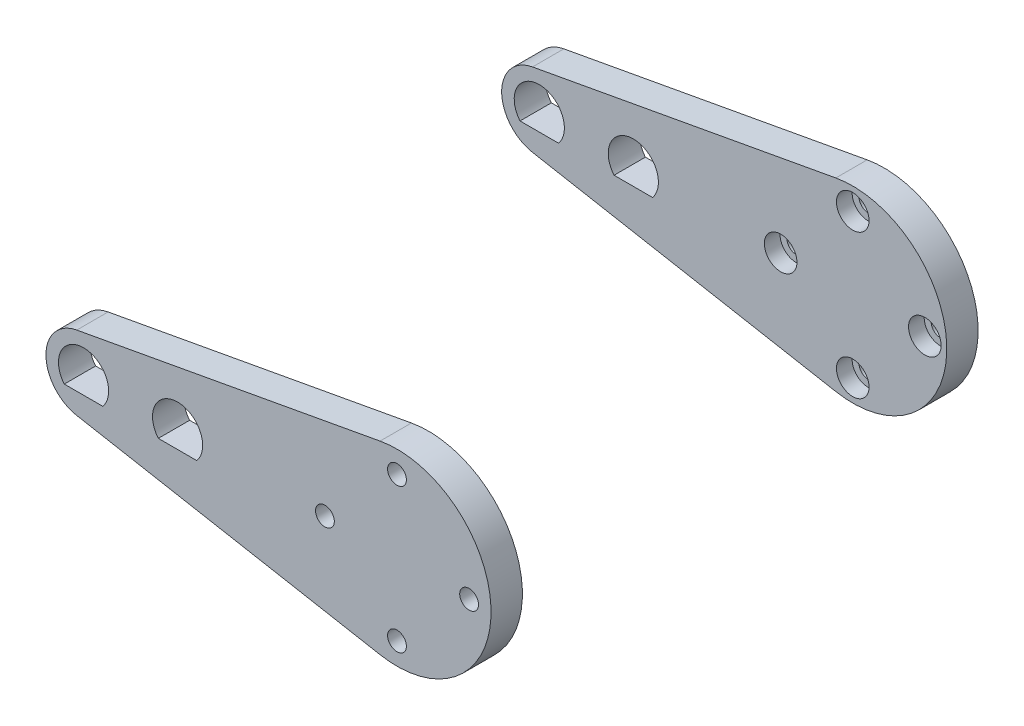
from build123d import *

# Parameters (mm, degrees)
SKETCH1_R           = 15
SKETCH1_R_2         = 2.6
BOSS_EXTRUDE1_DEPTH = 5
SKETCH1_3_R         = 2.6
SKETCH1_3_R_2       = 1.5
BOSS_EXTRUDE2_DEPTH = 2.5
BOSS_EXTRUDE3_DEPTH = 5


with BuildPart() as part:
    # Sketch1 → Boss-Extrude1 (new body)
    with BuildSketch(Plane.XY):
        Circle(SKETCH1_R)
        with Locations((-11.5, 0)):
            Circle(SKETCH1_R_2, mode=Mode.SUBTRACT)
        with Locations((0, -11.5)):
            Circle(SKETCH1_R_2, mode=Mode.SUBTRACT)
        with Locations((11.5, 0)):
            Circle(SKETCH1_R_2, mode=Mode.SUBTRACT)
        with Locations((0, 11.5)):
            Circle(SKETCH1_R_2, mode=Mode.SUBTRACT)
    extrude(amount=BOSS_EXTRUDE1_DEPTH)

    # Sketch1<3> → Boss-Extrude2 (add)
    # profile 1 of 4: a face of its own
    with BuildSketch(Plane.XY):
        with Locations((0, 11.5)):
            Circle(SKETCH1_3_R)
        with Locations((0, 11.5)):
            Circle(SKETCH1_3_R_2, mode=Mode.SUBTRACT)
    # profile 2 of 4: a face of its own
    with BuildSketch(Plane.XY):
        with Locations((11.5, 0)):
            Circle(SKETCH1_3_R)
        with Locations((11.5, 0)):
            Circle(SKETCH1_3_R_2, mode=Mode.SUBTRACT)
    # profile 3 of 4: a face of its own
    with BuildSketch(Plane.XY):
        with Locations((0, -11.5)):
            Circle(SKETCH1_3_R)
        with Locations((0, -11.5)):
            Circle(SKETCH1_3_R_2, mode=Mode.SUBTRACT)
    # profile 4 of 4: a face of its own
    with BuildSketch(Plane.XY):
        with Locations((-11.5, 0)):
            Circle(SKETCH1_3_R)
        with Locations((-11.5, 0)):
            Circle(SKETCH1_3_R_2, mode=Mode.SUBTRACT)
    extrude(amount=BOSS_EXTRUDE2_DEPTH)

    # Sketch2 → Boss-Extrude3 (add)
    with BuildSketch(Plane.XY):
        with BuildLine():
            Line((-2.7, 14.754999153), (-51.08, 5.901999661))
            ThreePointArc((-51.08, 5.901999661), (-56, 0), (-51.08, -5.901999661))
            Line((-51.08, -5.901999661), (-2.7, -14.754999153))
            ThreePointArc((-2.7, -14.754999153), (-15, 0), (-2.7, 14.754999153))
        make_face()
        with BuildLine():
            Line((-46.925, -2.558197608), (-53.075, -2.558197608))
            ThreePointArc((-53.075, -2.558197608), (-50, 4), (-46.925, -2.558197608))
        make_face(mode=Mode.SUBTRACT)
        with BuildLine():
            Line((-31.925, -2.558197608), (-38.075, -2.558197608))
            ThreePointArc((-38.075, -2.558197608), (-35, 4), (-31.925, -2.558197608))
        make_face(mode=Mode.SUBTRACT)
    extrude(amount=BOSS_EXTRUDE3_DEPTH)


with BuildPart() as body_2:
    # Mirror2: mirrored copy
    add(part.part.mirror(Plane.XY.offset(38.847994838)))


solid = Compound([part.part, body_2.part])
